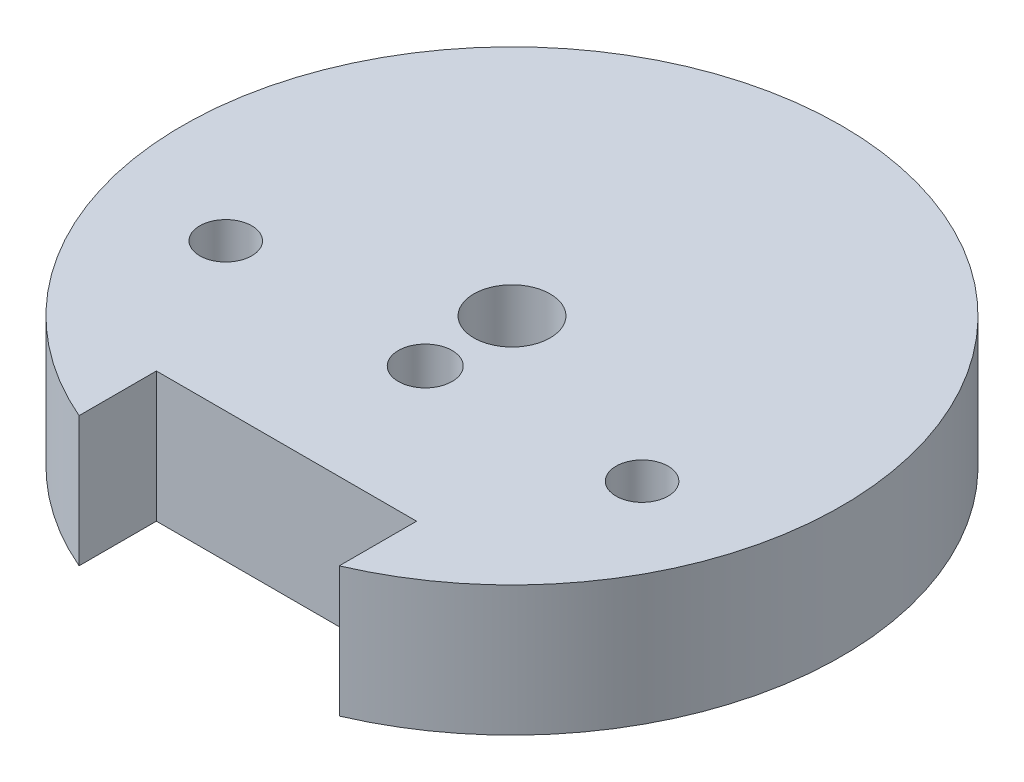
from build123d import *

# Parameters (mm, degrees)
SKETCH1_R              = 3.81
SKETCH1_R_2            = 3.937
SKETCH1_R_3            = 5.588
BOSS_EXTRUDE1_DEPTH    = 19.05
SKETCH2_W              = 175.508996812
SKETCH2_H              = 124.727535594
SKETCH2_R              = 48.26
TOLERANCE_ADJUST_DEPTH = 63.5


with BuildPart() as part:
    # Sketch1 → Boss-Extrude1 (new body)
    with BuildSketch(Plane(origin=(0, 0, 0), x_dir=(1, 0, 0), z_dir=(0, 1, 0))):
        with BuildLine():
            Line((-19.05, -33.02), (19.05, -33.02))
            Line((19.05, -33.02), (19.05, -45.72))
            ThreePointArc((19.05, -45.72), (41.211451079, -27.474300719), (49.53, 0))
            ThreePointArc((49.53, 0), (-27.474300719, 41.211451079), (-19.05, -45.72))
            Line((-19.05, -45.72), (-19.05, -33.02))
        make_face()
        with Locations(Location((-30.48, -11.43, 0), (0, 0, 90))):
            Circle(SKETCH1_R, mode=Mode.SUBTRACT)
        with Locations(Location((0, -12.7, 0), (0, 0, 90))):
            Circle(SKETCH1_R_2, mode=Mode.SUBTRACT)
        with Locations(Location((30.48, -11.43, 0), (0, 0, 90))):
            Circle(SKETCH1_R, mode=Mode.SUBTRACT)
        with Locations(Location((0, 0, 0), (0, 0, 90))):
            Circle(SKETCH1_R_3, mode=Mode.SUBTRACT)
    extrude(amount=BOSS_EXTRUDE1_DEPTH)

    # Sketch2 → Tolerance Adjust (cut)
    with BuildSketch(Plane(origin=(0, 0, 0), x_dir=(1, 0, 0), z_dir=(0, 1, 0))):
        Rectangle(SKETCH2_W, SKETCH2_H)
        Circle(SKETCH2_R, mode=Mode.SUBTRACT)
    extrude(amount=TOLERANCE_ADJUST_DEPTH, mode=Mode.SUBTRACT)


solid = part.part
